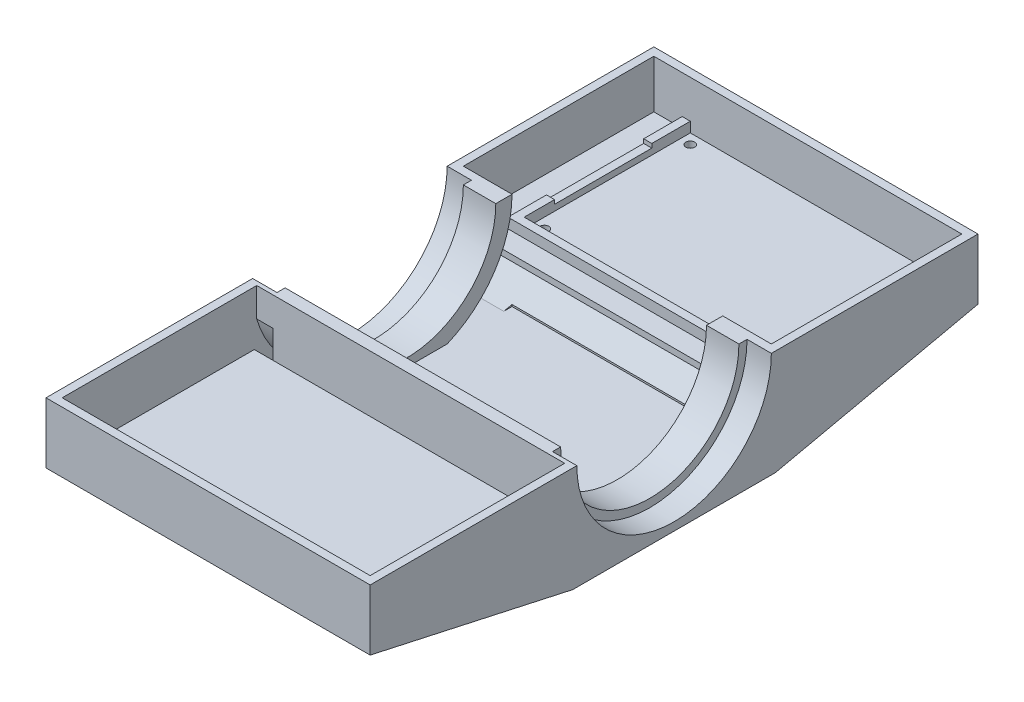
from build123d import *

# Parameters (mm, degrees)
EXTRUDE_1_DEPTH          = 40
EXTRUDE_1_DEPTH_BACK     = 40
CUT_EXTRUDE_2_DEPTH      = 34
CUT_EXTRUDE_2_DEPTH_BACK = 34
CUT_EXTRUDE_3_DEPTH      = 38
CUT_EXTRUDE_3_DEPTH_BACK = 38
EXTRUDE_2_DEPTH          = 76
CUT_EXTRUDE_START        = -4
SKETCH_9_R               = 24
CUT_EXTRUDE_4_DEPTH      = 4
SKETCH_10_R              = 24
CUT_EXTRUDE_5_DEPTH      = 4
SKETCH_11_W              = 52
SKETCH_11_H              = 52
CUT_EXTRUDE_6_DEPTH      = 24
SKETCH_16_W              = 76
SKETCH_16_H              = 2
CUT_EXTRUDE_8_DEPTH      = 23.5
EXTRUDE_4_DEPTH          = 77.5
SKETCH_19_W              = 68
SKETCH_19_H              = 3
EXTRUDE_6_DEPTH          = 27
SKETCH_21_W              = 14
SKETCH_21_H              = 10
CUT_EXTRUDE_10_DEPTH     = 2
SKETCH_22_W              = 14
SKETCH_22_H              = 10
CUT_EXTRUDE_11_DEPTH     = 6
EXTRUDE_7_DEPTH          = 1.4
CUT_EXTRUDE_12_DEPTH     = 3.4
SKETCH_25_W              = 68
SKETCH_25_H              = 1
CUT_EXTRUDE_13_DEPTH     = 3.4
SKETCH_26_W              = 48
SKETCH_26_H              = 1.5
EXTRUDE_8_DEPTH          = 78
SKETCH_27_W              = 71
SKETCH_27_H              = 45
SKETCH_27_W_2            = 67
SKETCH_27_H_2            = 41
EXTRUDE_9_DEPTH          = 2.5
SKETCH_28_R              = 1.1
CUT_EXTRUDE_14_DEPTH     = 2
SKETCH_29_W              = 2
SKETCH_29_H              = 24
CUT_EXTRUDE_15_DEPTH     = 1


with BuildPart() as part:
    # Эскиз1 → Бобышка-Вытянуть1 (new, two sides: drawn at the far end of the back side and taken through both)
    with BuildSketch(Plane(origin=(0, 0, 0), x_dir=(0, 0, -1), z_dir=(1, 0, 0)).offset(-EXTRUDE_1_DEPTH_BACK)):
        with BuildLine():
            Line((-75, 0), (-75, -15))
            Line((-75, -15), (-25, -26))
            Line((-25, -26), (-4.563728592, -26))
            Line((-4.563728592, -26), (25, -26))
            Line((25, -26), (75, -15))
            Line((75, -15), (75, 0))
            Line((75, 0), (24, 0))
            ThreePointArc((24, 0), (0, -24), (-24, 0))
            Line((-24, 0), (-75, 0))
        make_face()
    extrude(amount=EXTRUDE_1_DEPTH + EXTRUDE_1_DEPTH_BACK)

    # Эскиз3 → Вырез-Вытянуть2 (cut, two sides: drawn at the far end of the back side and taken through both)
    with BuildSketch(Plane(origin=(0, 0, 0), x_dir=(0, 0, -1), z_dir=(1, 0, 0)).offset(-CUT_EXTRUDE_2_DEPTH_BACK)):
        Polygon((26, 0), (73, 0), (73, -13.392171882), (23.878685446, -24), (-24.782599465, -24), (-73, -13.400590035), (-73, 0), (-26, 0), align=None)
    extrude(amount=CUT_EXTRUDE_2_DEPTH + CUT_EXTRUDE_2_DEPTH_BACK, mode=Mode.SUBTRACT)

    # Эскиз7 → Вырез-Вытянуть3 (cut, two sides: drawn at the far end of the back side and taken through both)
    with BuildSketch(Plane(origin=(0, 0, 0), x_dir=(0, 0, -1), z_dir=(1, 0, 0)).offset(-CUT_EXTRUDE_3_DEPTH_BACK)):
        Polygon((-26.2, 0), (26.2, 0), (73, 0), (73, -13.392171882), (23.963305429, -24), (10.509043724, -24), (-10.509043724, -24), (-24.782599465, -24), (-73, -14.042818852), (-73, 0), align=None)
    extrude(amount=CUT_EXTRUDE_3_DEPTH + CUT_EXTRUDE_3_DEPTH_BACK, mode=Mode.SUBTRACT)

    # Эскиз8 → Бобышка-Вытянуть2 (add)
    with BuildSketch(Plane(origin=(-38, 0, 0), x_dir=(0, 0, -1), z_dir=(1, 0, 0))):
        with BuildLine():
            Line((-26, 0), (-22, 0))
            ThreePointArc((-22, 0), (0, -22), (22, 0))
            Line((22, 0), (26, 0))
            ThreePointArc((26, 0), (0, -26), (-26, 0))
        make_face()
    extrude(amount=EXTRUDE_2_DEPTH)

    # Эскиз9 → Вырез-Вытянуть4 (cut)
    with BuildSketch(Plane(origin=(38, 0, 0), x_dir=(0, 0, -1), z_dir=(1, 0, 0)).offset(CUT_EXTRUDE_START)):
        Circle(SKETCH_9_R)
    extrude(amount=CUT_EXTRUDE_4_DEPTH, mode=Mode.SUBTRACT)

    # Эскиз10 → Вырез-Вытянуть5 (cut)
    with BuildSketch(Plane.ZY.offset(38)):
        Circle(SKETCH_10_R)
    extrude(amount=-CUT_EXTRUDE_5_DEPTH, mode=Mode.SUBTRACT)

    # Эскиз11 → Вырез-Вытянуть6 (cut)
    with BuildSketch(Plane(origin=(0, 0, 0), x_dir=(1, 0, 0), z_dir=(0, 1, 0))):
        Rectangle(SKETCH_11_W, SKETCH_11_H)
    extrude(amount=-CUT_EXTRUDE_6_DEPTH, mode=Mode.SUBTRACT)

    # Эскиз16 → Вырез-Вытянуть8 (cut)
    with BuildSketch(Plane(origin=(0, 0, 0), x_dir=(1, 0, 0), z_dir=(0, 1, 0))):
        with Locations((0, -26)):
            Rectangle(SKETCH_16_W, SKETCH_16_H)
    extrude(amount=-CUT_EXTRUDE_8_DEPTH, mode=Mode.SUBTRACT)

    # Эскиз17 → Бобышка-Вытянуть4 (add)
    with BuildSketch(Plane(origin=(-38, 0, 0), x_dir=(0, 0, -1), z_dir=(1, 0, 0))):
        Polygon((-73, -13.392171882), (-25.598256637, -13.392171882), (-25.598256637, -25.86838354), (-27.098256637, -25.53838354), (-27.098256637, -14.892171882), (-73, -14.892171882), align=None)
    extrude(amount=EXTRUDE_4_DEPTH)

    # Эскиз19 → Бобышка-Вытянуть6 (add)
    with BuildSketch(Plane(origin=(0, 0, 0), x_dir=(1, 0, 0), z_dir=(0, 1, 0))):
        with Locations((0, -23.5)):
            Rectangle(SKETCH_19_W, SKETCH_19_H)
    extrude(amount=-EXTRUDE_6_DEPTH)

    # Эскиз21 → Вырез-Вытянуть10 (cut)
    with BuildSketch(Plane(origin=(0, -30.045784052, 6.610072491), x_dir=(1, 0, 0), z_dir=(0, -0.9766444667050901, 0.21486178267511963))):
        with Locations((-31, 63.025408263)):
            Rectangle(SKETCH_21_W, SKETCH_21_H)
    extrude(amount=-CUT_EXTRUDE_10_DEPTH, mode=Mode.SUBTRACT)

    # Эскиз22 → Вырез-Вытянуть11 (cut)
    with BuildSketch(Plane(origin=(0, -13.392171882, 0), x_dir=(1, 0, 0), z_dir=(0, 1, 0))):
        with Locations((-31, -68)):
            Rectangle(SKETCH_22_W, SKETCH_22_H)
    extrude(amount=-CUT_EXTRUDE_11_DEPTH, mode=Mode.SUBTRACT)

    # Эскиз23 → Бобышка-Вытянуть7 (add)
    with BuildSketch(Plane.XZ.offset(14.892171882)):
        Polygon((-38, 63), (-24, 63), (-24, 73.046711067), (-22.5, 73.046711067), (-22.5, 64.14337403), (-22.5, 61.5), (-38, 61.5), align=None)
    extrude(amount=EXTRUDE_7_DEPTH)

    # Эскиз24 → Вырез-Вытянуть12 (cut)
    with BuildSketch(Plane(origin=(-22.5, 0, 0), x_dir=(0, 0, -1), z_dir=(1, 0, 0))):
        Polygon((-73.046711067, -15.429723565), (-69.126491444, -16.292171882), (-73.046711067, -16.292171882), align=None)
    extrude(amount=-CUT_EXTRUDE_12_DEPTH, mode=Mode.SUBTRACT)

    # Эскиз25 → Вырез-Вытянуть13 (cut)
    with BuildSketch(Plane(origin=(0, 0, 22), x_dir=(-1, 0, 0), z_dir=(0, 0, -1))):
        with Locations((0, -26.5)):
            Rectangle(SKETCH_25_W, SKETCH_25_H)
    extrude(amount=-CUT_EXTRUDE_13_DEPTH, mode=Mode.SUBTRACT)

    # Эскиз26 → Бобышка-Вытянуть8 (add)
    with BuildSketch(Plane.ZY.offset(-38)):
        with Locations((-49, -12.642171882)):
            Rectangle(SKETCH_26_W, SKETCH_26_H)
    extrude(amount=EXTRUDE_8_DEPTH)

    # Эскиз27 → Бобышка-Вытянуть9 (add)
    with BuildSketch(Plane(origin=(0, -11.892171882, 0), x_dir=(1, 0, 0), z_dir=(0, 1, 0))):
        with Locations((4.5, 52.5)):
            Rectangle(SKETCH_27_W, SKETCH_27_H)
        with Locations((4.5, 52.5)):
            Rectangle(SKETCH_27_W_2, SKETCH_27_H_2, mode=Mode.SUBTRACT)
    extrude(amount=EXTRUDE_9_DEPTH)

    # Эскиз28 → Вырез-Вытянуть14 (cut)
    with BuildSketch(Plane(origin=(0, -11.892171882, 0), x_dir=(1, 0, 0), z_dir=(0, 1, 0))):
        with Locations((-26.5, 70.5)):
            Circle(SKETCH_28_R)
        with Locations((-26.5, 34.5)):
            Circle(SKETCH_28_R)
        with Locations((35.5, 70.5)):
            Circle(SKETCH_28_R)
        with Locations((35.5, 34.5)):
            Circle(SKETCH_28_R)
    extrude(amount=-CUT_EXTRUDE_14_DEPTH, mode=Mode.SUBTRACT)

    # Эскиз29 → Вырез-Вытянуть15 (cut)
    with BuildSketch(Plane(origin=(0, -9.392171882, 0), x_dir=(1, 0, 0), z_dir=(0, 1, 0))):
        with Locations((-30, 51.5)):
            Rectangle(SKETCH_29_W, SKETCH_29_H)
    extrude(amount=-CUT_EXTRUDE_15_DEPTH, mode=Mode.SUBTRACT)


solid = part.part
